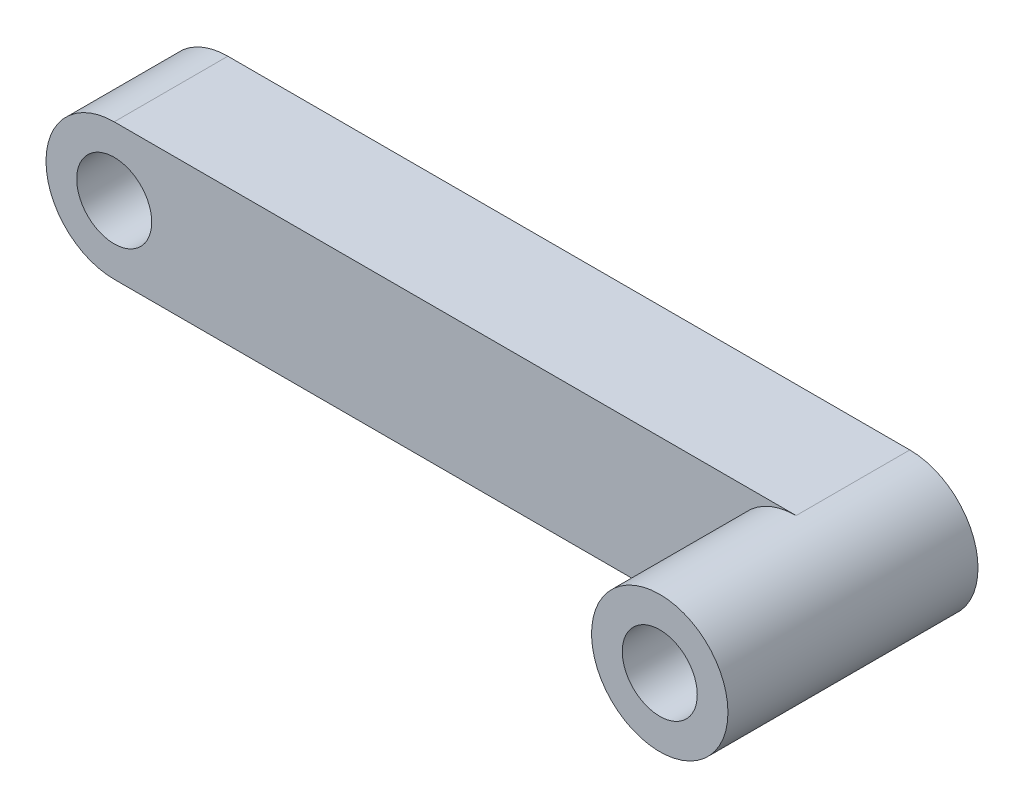
from build123d import *

# Parameters (mm, degrees)
SKIZZE1_R                       = 1.65
AUFSATZ_LINEAR_AUSTRAGEN1_DEPTH = 5
SKIZZE2_R                       = 3
SKIZZE2_R_2                     = 1.65
AUFSATZ_LINEAR_AUSTRAGEN2_DEPTH = 6


with BuildPart() as part:
    # Skizze1 → Aufsatz-Linear austragen1 (new body)
    with BuildSketch(Plane.XY):
        with BuildLine():
            Line((0, 3), (-30, 3))
            ThreePointArc((-30, 3), (-33, 0), (-30, -3))
            Line((-30, -3), (0, -3))
            ThreePointArc((0, -3), (3, 0), (0, 3))
        make_face()
        Circle(SKIZZE1_R, mode=Mode.SUBTRACT)
        with Locations((-30, 0)):
            Circle(SKIZZE1_R, mode=Mode.SUBTRACT)
    extrude(amount=AUFSATZ_LINEAR_AUSTRAGEN1_DEPTH)

    # Skizze2 → Aufsatz-Linear austragen2 (add)
    with BuildSketch(Plane.XY.offset(5)):
        with Locations(Location((0, 0, 0), (0, 0, 90))):
            Circle(SKIZZE2_R)
        Circle(SKIZZE2_R_2, mode=Mode.SUBTRACT)
    extrude(amount=AUFSATZ_LINEAR_AUSTRAGEN2_DEPTH)


solid = part.part
